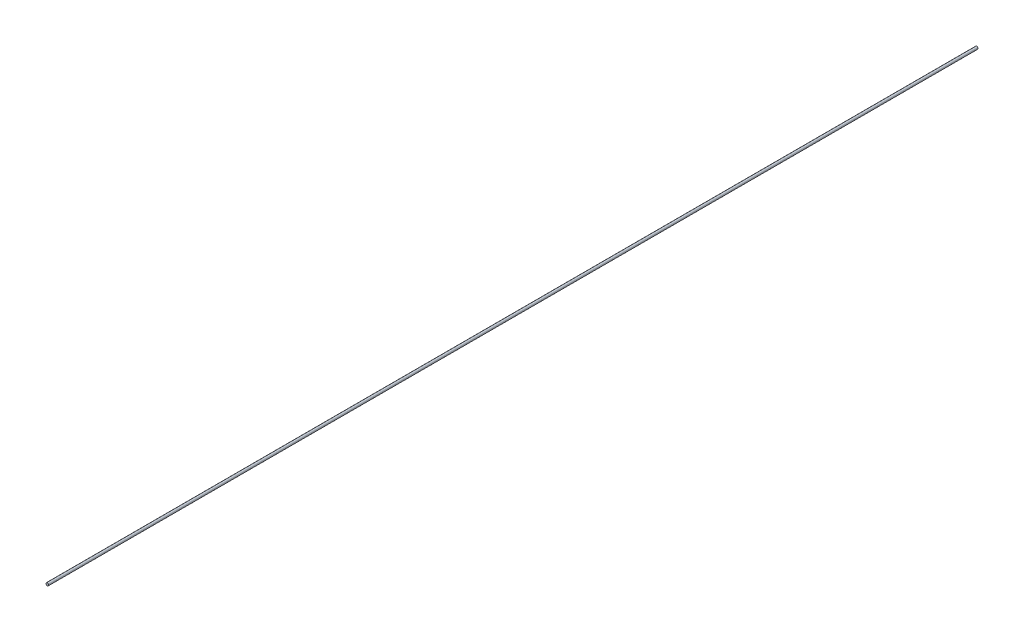
from build123d import *

# Parameters (mm, degrees)
SKETCH1_R           = 1.5
BOSS_EXTRUDE1_DEPTH = 1060


with BuildPart() as part:
    # Sketch1 → Boss-Extrude1 (new body)
    with BuildSketch(Plane.XY):
        Circle(SKETCH1_R)
    extrude(amount=BOSS_EXTRUDE1_DEPTH)


solid = part.part
